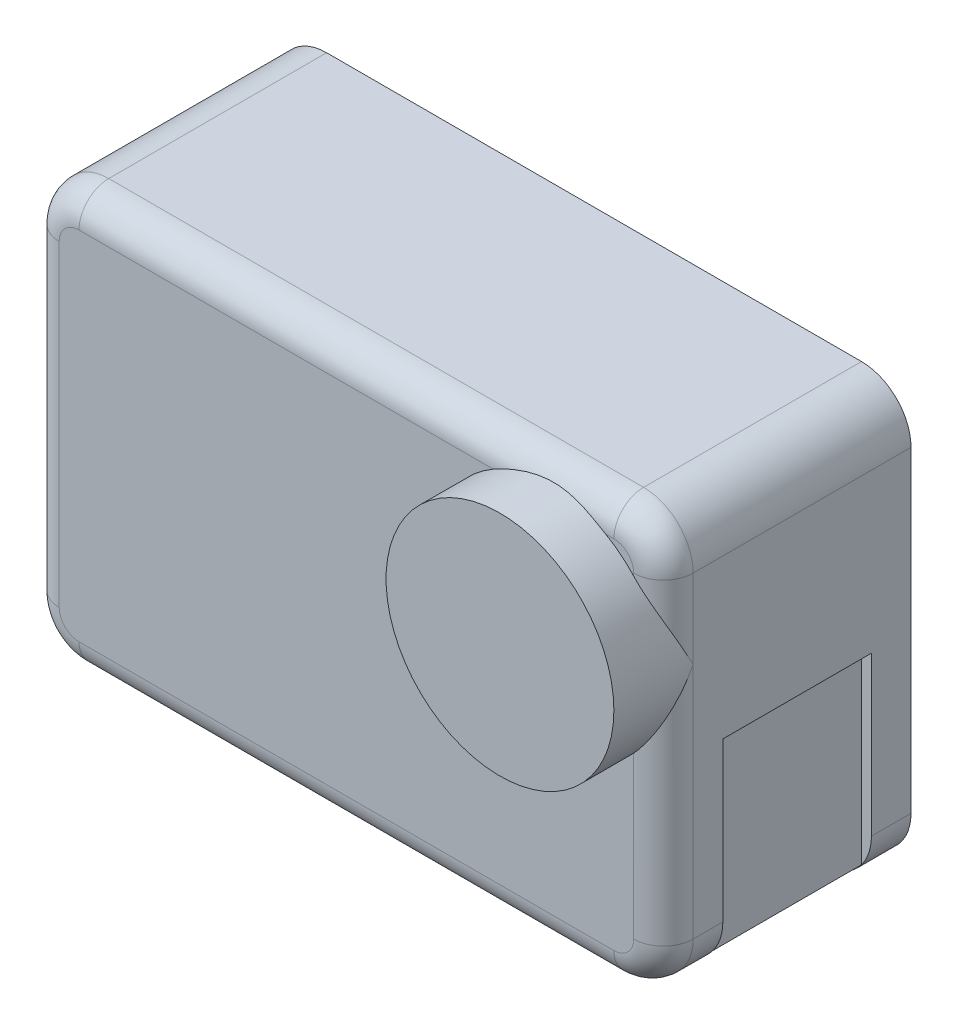
from build123d import *

# Parameters (mm, degrees)
SKETCH1_W           = 64
SKETCH1_H           = 42
BOSS_EXTRUDE1_DEPTH = 25
FILLET2_R           = 5
FILLET4_R           = 3
BOSS_EXTRUDE3_START = -3
SKETCH2_R           = 11.5
BOSS_EXTRUDE3_DEPTH = 8
SKETCH3_W           = 15
SKETCH3_H           = 21
CUT_EXTRUDE1_DEPTH  = 1
SKETCH4_W           = 15
SKETCH4_H           = 2
CUT_EXTRUDE2_DEPTH  = 5


with BuildPart() as part:
    # Sketch1 → Boss-Extrude1 (new body)
    with BuildSketch(Plane.XY):
        with Locations((32, 21)):
            Rectangle(SKETCH1_W, SKETCH1_H)
    extrude(amount=BOSS_EXTRUDE1_DEPTH)

    # Fillet2
    fillet2_edges = [part.edges().sort_by_distance(p)[0] for p in [
        (0, 42, 12.5),
        (64, 42, 12.5),
        (64, 0, 12.5),
        (0, 0, 12.5),
    ]]
    fillet(fillet2_edges, radius=FILLET2_R)

    # Fillet4
    fillet4_edges = [part.edges().sort_by_distance(p)[0] for p in [
        (64, 21, 25),
        (32, 0, 25),
        (0, 21, 25),
        (32, 42, 25),
        (62.535533906, 40.535533906, 25),
        (1.464466094, 40.535533906, 25),
        (1.464466094, 1.464466094, 25),
        (62.535533906, 1.464466094, 25),
    ]]
    fillet(fillet4_edges, radius=FILLET4_R)

    # Sketch2 → Boss-Extrude3 (add)
    with BuildSketch(Plane.XY.offset(25).offset(BOSS_EXTRUDE3_START)):
        with Locations((52.5, 29)):
            Circle(SKETCH2_R)
    extrude(amount=BOSS_EXTRUDE3_DEPTH)

    # Sketch3 → Cut-Extrude1 (cut)
    with BuildSketch(Plane(origin=(64, 0, 0), x_dir=(0, 0, -1), z_dir=(1, 0, 0))):
        with Locations((-11.5, 10.5)):
            Rectangle(SKETCH3_W, SKETCH3_H)
    extrude(amount=-CUT_EXTRUDE1_DEPTH, mode=Mode.SUBTRACT)

    # Sketch4 → Cut-Extrude2 (cut)
    with BuildSketch(Plane(origin=(63, 0, 0), x_dir=(0, 0, -1), z_dir=(1, 0, 0))):
        with Locations((-11.5, 1)):
            Rectangle(SKETCH4_W, SKETCH4_H)
    extrude(amount=-CUT_EXTRUDE2_DEPTH, mode=Mode.SUBTRACT)


solid = part.part
